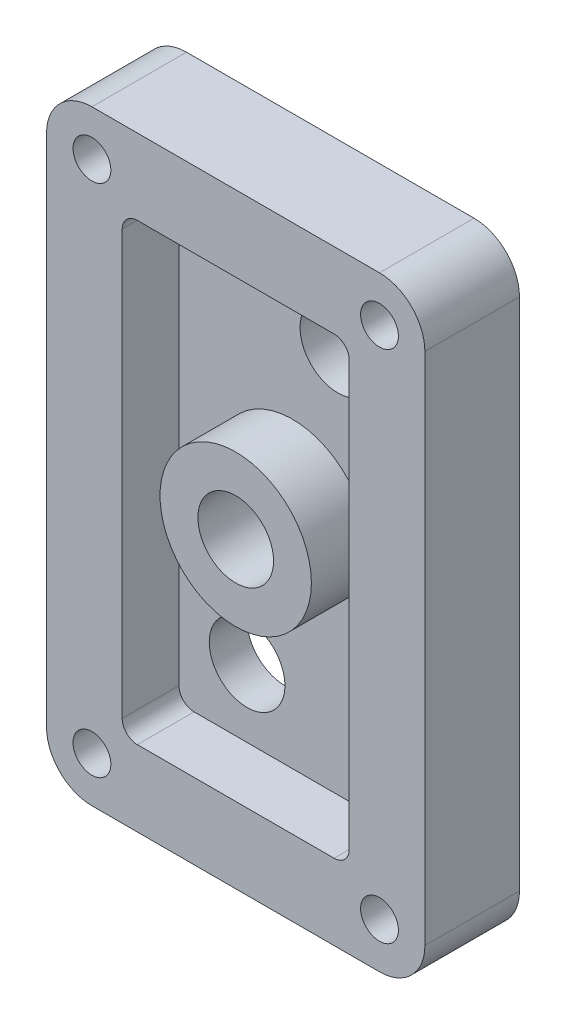
from build123d import *

# Parameters (mm, degrees)
ESQUISSE1_W             = 1000
ESQUISSE1_H             = 1600
ESQUISSE1_R             = 50
ESQUISSE1_W_2           = 600
ESQUISSE1_H_2           = 1200
ESQUISSE1_R_2           = 100
ESQUISSE1_R_3           = 200
BOSS_EXTRU_1_DEPTH      = 250
ESQUISSE3_R             = 200
ENL_V_MAT_EXTRU_1_DEPTH = 150
CONG_1_R                = 120


with BuildPart() as part:
    # Esquisse1 → Boss.-Extru.1 (new body)
    # profile 1 of 3: a face of its own
    with BuildSketch(Plane.XY):
        with Locations((500, 800)):
            Rectangle(ESQUISSE1_W, ESQUISSE1_H)
        with Locations((880, 1480)):
            Circle(ESQUISSE1_R, mode=Mode.SUBTRACT)
        with Locations((120, 1480)):
            Circle(ESQUISSE1_R, mode=Mode.SUBTRACT)
        with Locations((880, 120)):
            Circle(ESQUISSE1_R, mode=Mode.SUBTRACT)
        with Locations((120, 120)):
            Circle(ESQUISSE1_R, mode=Mode.SUBTRACT)
        with Locations((500, 800)):
            Rectangle(ESQUISSE1_W_2, ESQUISSE1_H_2, mode=Mode.SUBTRACT)
    # profile 2 of 3: a face of its own
    with BuildSketch(Plane.XY):
        with Locations((500, 800)):
            Rectangle(ESQUISSE1_W_2, ESQUISSE1_H_2)
        with Locations((620, 1220)):
            Circle(ESQUISSE1_R_2, mode=Mode.SUBTRACT)
        with Locations((380, 380)):
            Circle(ESQUISSE1_R_2, mode=Mode.SUBTRACT)
        with Locations((500, 800)):
            Circle(ESQUISSE1_R_3, mode=Mode.SUBTRACT)
    # profile 3 of 3: a face of its own
    with BuildSketch(Plane.XY):
        with Locations((500, 800)):
            Circle(ESQUISSE1_R_3)
        with Locations((500, 800)):
            Circle(ESQUISSE1_R_2, mode=Mode.SUBTRACT)
    extrude(amount=BOSS_EXTRU_1_DEPTH)

    # Esquisse3 → Enlèv. mat.-Extru.1 (cut)
    with BuildSketch(Plane.XY.offset(250)):
        with BuildLine():
            Line((240, 1400), (760, 1400))
            ThreePointArc((760, 1400), (788.284271247, 1388.284271247), (800, 1360))
            Line((800, 1360), (800, 240))
            ThreePointArc((800, 240), (788.284271247, 211.715728753), (760, 200))
            Line((760, 200), (240, 200))
            ThreePointArc((240, 200), (211.715728753, 211.715728753), (200, 240))
            Line((200, 240), (200, 1360))
            ThreePointArc((200, 1360), (211.715728753, 1388.284271247), (240, 1400))
        make_face()
        with Locations((500, 800)):
            Circle(ESQUISSE3_R, mode=Mode.SUBTRACT)
    extrude(amount=-ENL_V_MAT_EXTRU_1_DEPTH, mode=Mode.SUBTRACT)

    # Congé1
    cong_1_edges = [part.edges().sort_by_distance(p)[0] for p in [
        (0, 0, 125),
        (0, 1600, 125),
        (1000, 1600, 125),
        (1000, 0, 125),
    ]]
    fillet(cong_1_edges, radius=CONG_1_R)


solid = part.part
